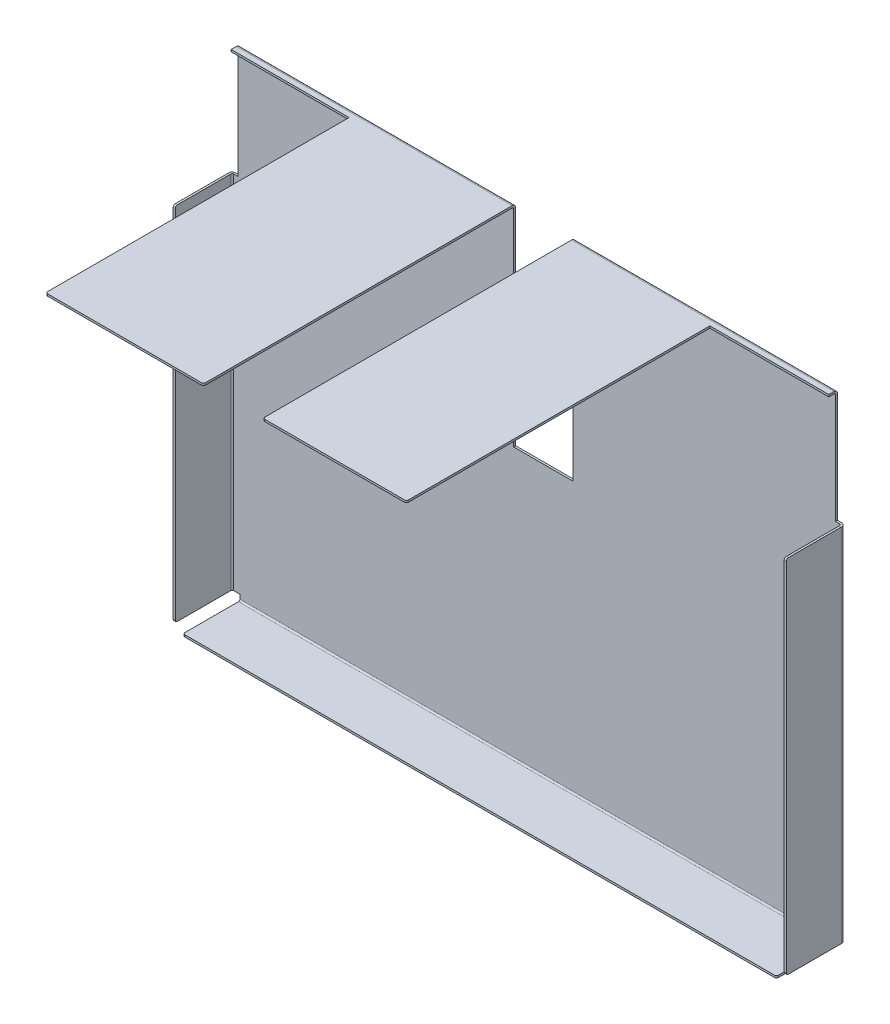
from build123d import *

# Parameters (mm, degrees)
SKETCH1_W           = 299.030753262
SKETCH1_H           = 176
BOSS_EXTRUDE1_DEPTH = 28.765376631
SKETCH2_W           = 297.030753262
SKETCH2_H           = 27.765376631
CUT_EXTRUDE1_DEPTH  = 372.704572948
SKETCH3_W           = 29
SKETCH3_H           = 47
CUT_EXTRUDE2_DEPTH  = 366.805713875
SKETCH4_W           = 134.5
SKETCH4_H           = 1
BOSS_EXTRUDE2_DEPTH = 55.265376631
SKETCH5_W           = 134.5
SKETCH5_H           = 1
BOSS_EXTRUDE3_DEPTH = 151.265376631
SKETCH6_W           = 128
SKETCH6_H           = 1
BOSS_EXTRUDE4_DEPTH = 55.265376631
SKETCH7_W           = 128
SKETCH7_H           = 1
BOSS_EXTRUDE5_DEPTH = 151.265376631
SKETCH8_W           = 289.5
SKETCH8_H           = 1
BOSS_EXTRUDE6_DEPTH = 3.765376631
SKETCH9_W           = 289.5
SKETCH9_H           = 1
BOSS_EXTRUDE7_DEPTH = 27.765376631
SKETCH10_W          = 57.5
SKETCH10_H          = 148
CUT_EXTRUDE3_DEPTH  = 430.032610708
SKETCH11_W          = 58
SKETCH11_H          = 148
CUT_EXTRUDE4_DEPTH  = 430.032610708
FILLET1_R           = 0.7366
FILLET2_R           = 1
FILLET3_R           = 1.7366


with BuildPart() as part:
    # Sketch1 → Boss-Extrude1 (new body)
    with BuildSketch(Plane(origin=(0, 0, -1), x_dir=(-1, 0, 0), z_dir=(0, 0, -1))):
        with Locations((176.701381692, -75)):
            Rectangle(SKETCH1_W, SKETCH1_H)
    extrude(amount=-BOSS_EXTRUDE1_DEPTH)

    # Sketch2 → Cut-Extrude1 (cut, through all)
    with BuildSketch(Plane.XZ.offset(163)):
        with Locations((-176.701381692, 13.882688316)):
            Rectangle(SKETCH2_W, SKETCH2_H)
    extrude(amount=-CUT_EXTRUDE1_DEPTH, mode=Mode.SUBTRACT)

    # Sketch3 → Cut-Extrude2 (cut, through all)
    with BuildSketch(Plane(origin=(0, 0, -1), x_dir=(-1, 0, 0), z_dir=(0, 0, -1))):
        with Locations((173.451381692, -10.5)):
            Rectangle(SKETCH3_W, SKETCH3_H)
    extrude(amount=-CUT_EXTRUDE2_DEPTH, mode=Mode.SUBTRACT)

    # Sketch4 → Boss-Extrude2 (add)
    with BuildSketch(Plane(origin=(0, 13, 0), x_dir=(-1, 0, 0), z_dir=(0, 1, 0))):
        with Locations((255.201381692, -0.5)):
            Rectangle(SKETCH4_W, SKETCH4_H)
    extrude(amount=BOSS_EXTRUDE2_DEPTH)

    # Sketch5 → Boss-Extrude3 (add)
    with BuildSketch(Plane.XY):
        with Locations((-255.201381692, 67.765376631)):
            Rectangle(SKETCH5_W, SKETCH5_H)
    extrude(amount=BOSS_EXTRUDE3_DEPTH)

    # Sketch6 → Boss-Extrude4 (add)
    with BuildSketch(Plane(origin=(0, 13, 0), x_dir=(-1, 0, 0), z_dir=(0, 1, 0))):
        with Locations((94.951381692, -0.5)):
            Rectangle(SKETCH6_W, SKETCH6_H)
    extrude(amount=BOSS_EXTRUDE4_DEPTH)

    # Sketch7 → Boss-Extrude5 (add)
    with BuildSketch(Plane.XY):
        with Locations((-94.951381692, 67.765376631)):
            Rectangle(SKETCH7_W, SKETCH7_H)
    extrude(amount=BOSS_EXTRUDE5_DEPTH)

    # Sketch8 → Boss-Extrude6 (add)
    with BuildSketch(Plane.XZ.offset(163)):
        with Locations((-176.701381692, -0.5)):
            Rectangle(SKETCH8_W, SKETCH8_H)
    extrude(amount=BOSS_EXTRUDE6_DEPTH)

    # Sketch9 → Boss-Extrude7 (add)
    with BuildSketch(Plane.XY):
        with Locations((-176.701381692, -166.265376631)):
            Rectangle(SKETCH9_W, SKETCH9_H)
    extrude(amount=BOSS_EXTRUDE7_DEPTH)

    # Sketch10 → Cut-Extrude3 (cut, through all)
    with BuildSketch(Plane.XZ.offset(-67.265376631)):
        with Locations((-293.701381692, 77.265376631)):
            Rectangle(SKETCH10_W, SKETCH10_H)
    extrude(amount=-CUT_EXTRUDE3_DEPTH, mode=Mode.SUBTRACT)

    # Sketch11 → Cut-Extrude4 (cut, through all)
    with BuildSketch(Plane.XZ.offset(-67.265376631)):
        with Locations((-59.951381692, 77.265376631)):
            Rectangle(SKETCH11_W, SKETCH11_H)
    extrude(amount=-CUT_EXTRUDE4_DEPTH, mode=Mode.SUBTRACT)

    # Fillet1
    fillet1_edges = [part.edges().sort_by_distance(p)[0] for p in [
        (-176.701381692, -165.765376631, 0),
        (-28.186005061, -75, 0),
        (-325.216758323, -75, 0),
        (-255.201381692, 67.265376631, 0),
        (-94.951381692, 67.265376631, 0),
    ]]
    fillet(fillet1_edges, radius=FILLET1_R)

    # Fillet2
    fillet2_edges = [part.edges().sort_by_distance(p)[0] for p in [
        (-325.716758323, 13, 27.765376631),
        (-321.451381692, -166.265376631, 27.765376631),
        (-31.951381692, -166.265376631, 27.765376631),
        (-264.951381692, 67.765376631, 151.265376631),
        (-325.716758323, -163, 27.765376631),
        (-27.686005061, 13, 27.765376631),
        (-88.951381692, 67.765376631, 151.265376631),
        (-27.686005061, -163, 27.765376631),
        (-187.951381692, 67.765376631, 151.265376631),
        (-158.951381692, 67.765376631, 151.265376631),
    ]]
    fillet(fillet2_edges, radius=FILLET2_R)

    # Fillet3
    fillet3_edges = [part.edges().sort_by_distance(p)[0] for p in [
        (-176.701381692, -166.765376631, -1),
        (-27.186005061, -75, -1),
        (-255.201381692, 68.265376631, -1),
        (-326.216758323, -75, -1),
        (-94.951381692, 68.265376631, -1),
    ]]
    fillet(fillet3_edges, radius=FILLET3_R)


solid = part.part
